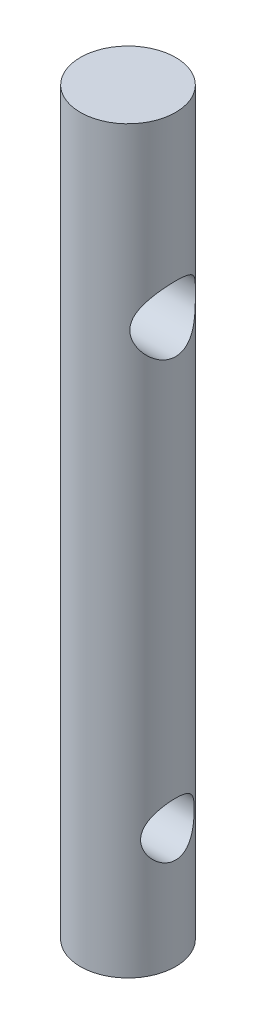
from build123d import *

# Parameters (mm, degrees)
SKETCH1_R            = 4
BOSS_EXTRUDE1_DEPTH  = 62.1
M5_CLEARANCE_HOLE1_D = 5.5
M4_CLEARANCE_HOLE1_D = 4.5


with BuildPart() as part:
    # Sketch1 → Boss-Extrude1 (new body)
    with BuildSketch(Plane(origin=(0, 0, 0), x_dir=(1, 0, 0), z_dir=(0, 1, 0))):
        with Locations(Location((0, 0, 0), (0, 0, 270))):
            Circle(SKETCH1_R)
    extrude(amount=BOSS_EXTRUDE1_DEPTH)

    # M5 Clearance Hole1 (through all)
    with Locations(Plane(origin=(-4, 0, 0), x_dir=(0, 0, -1), z_dir=(-1, 0, 0))):
        with Locations((0, -47.1)):
            Hole(M5_CLEARANCE_HOLE1_D / 2)

    # M4 Clearance Hole1 (through all)
    with Locations(Plane.ZY.offset(4)):
        with Locations((0, 10)):
            Hole(M4_CLEARANCE_HOLE1_D / 2)


solid = part.part
